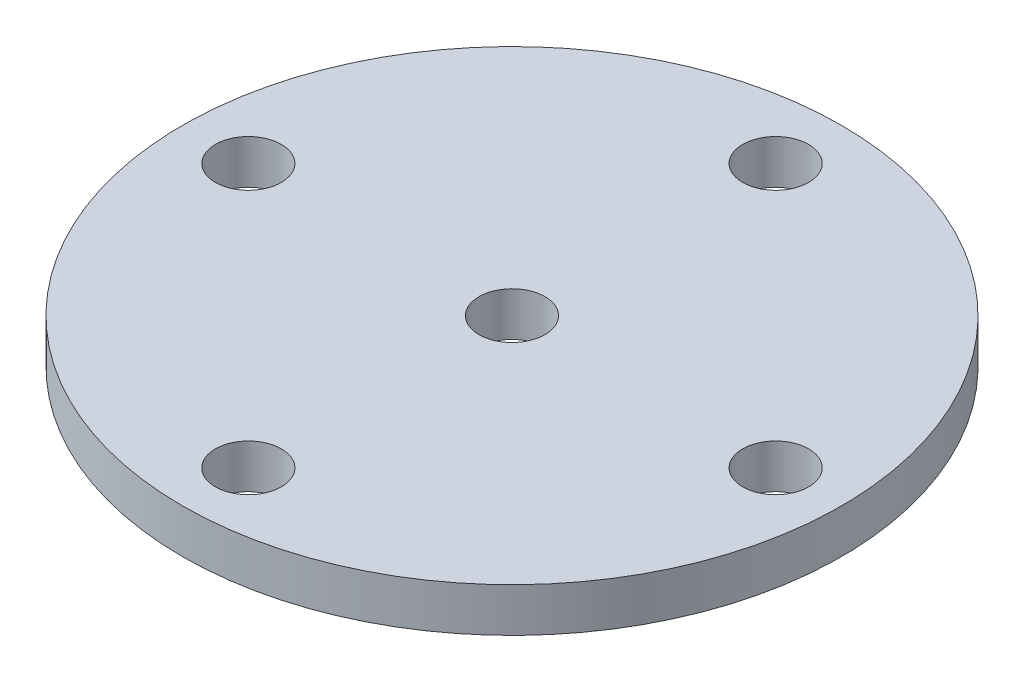
from build123d import *

# Parameters (mm, degrees)
CROQUIS1_R              = 15
CROQUIS1_R_2            = 1.5
SALIENTE_EXTRUIR1_DEPTH = 2


with BuildPart() as part:
    # Croquis1 → Saliente-Extruir1 (new body)
    with BuildSketch(Plane(origin=(0, 0, 0), x_dir=(1, 0, 0), z_dir=(0, 1, 0))):
        with Locations(Location((0, 0, 0), (0, 0, 270))):
            Circle(CROQUIS1_R)
        with Locations(Location((0, 0, 0), (0, 0, 270))):
            Circle(CROQUIS1_R_2, mode=Mode.SUBTRACT)
        with Locations(Location((-12, 0, 0), (0, 0, 270))):
            Circle(CROQUIS1_R_2, mode=Mode.SUBTRACT)
        with Locations(Location((12, 0, 0), (0, 0, 90))):
            Circle(CROQUIS1_R_2, mode=Mode.SUBTRACT)
        with Locations(Location((0, 12, 0), (0, 0, 270))):
            Circle(CROQUIS1_R_2, mode=Mode.SUBTRACT)
        with Locations(Location((0, -12, 0), (0, 0, 90))):
            Circle(CROQUIS1_R_2, mode=Mode.SUBTRACT)
    extrude(amount=SALIENTE_EXTRUIR1_DEPTH)


solid = part.part
